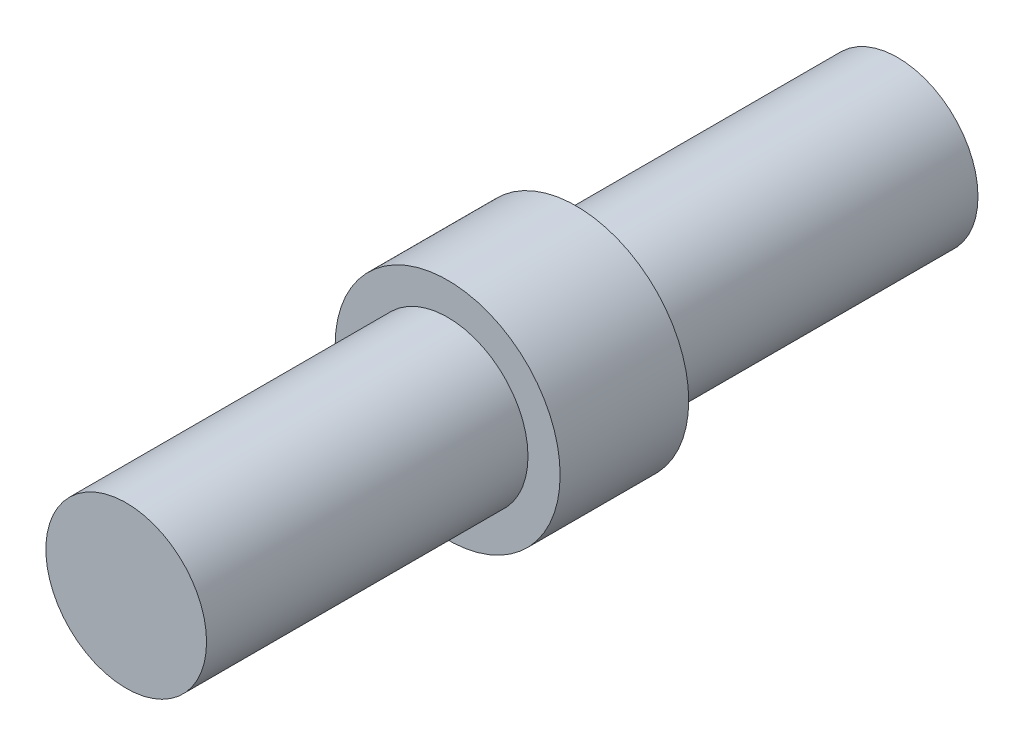
from build123d import *

# Parameters (mm, degrees)
SKETCH1_R           = 2.5
BOSS_EXTRUDE1_DEPTH = 10
SKETCH2_R           = 3.5
BOSS_EXTRUDE2_DEPTH = 4
BOSS_EXTRUDE3_START = 14
SKETCH1_2_R         = 2.5
BOSS_EXTRUDE3_DEPTH = 10


with BuildPart() as part:
    # Sketch1 → Boss-Extrude1 (new body)
    with BuildSketch(Plane.XY):
        Circle(SKETCH1_R)
    extrude(amount=BOSS_EXTRUDE1_DEPTH)

    # Sketch2 → Boss-Extrude2 (add)
    with BuildSketch(Plane.XY.offset(10)):
        Circle(SKETCH2_R)
    extrude(amount=BOSS_EXTRUDE2_DEPTH)

    # Sketch1<2> → Boss-Extrude3 (add)
    with BuildSketch(Plane.XY.offset(BOSS_EXTRUDE3_START)):
        Circle(SKETCH1_2_R)
    extrude(amount=BOSS_EXTRUDE3_DEPTH)


solid = part.part
